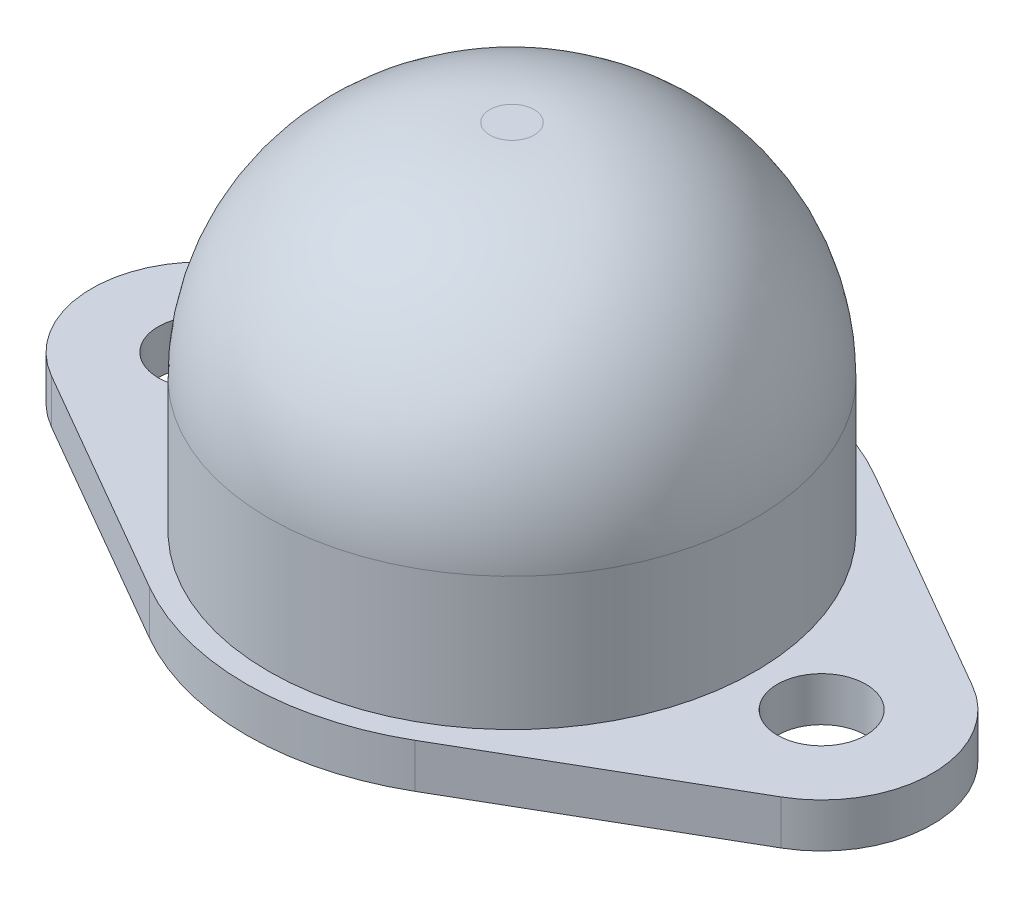
from build123d import *

# Parameters (mm, degrees)
BOSS_EXTRUDE1_DEPTH = 1
SKETCH2_R           = 5.5
BOSS_EXTRUDE2_DEPTH = 8
FILLET1_R           = 5


with BuildPart() as part:
    # Sketch1 → Boss-Extrude1 (new body)
    with BuildSketch(Plane(origin=(0, 0, 0), x_dir=(1, 0, 0), z_dir=(0, 1, 0))):
        with BuildLine():
            ThreePointArc((-8, 0), (-7, 1), (-6, 0))
            ThreePointArc((-6, 0), (-5.905505906, 1.060660172), (-5.625, 2.087911636))
            ThreePointArc((-5.625, 2.087911636), (-6.926553741, 2.498920897), (-8.25, 2.165063509))
            ThreePointArc((-8.25, 2.165063509), (-9.165063509, 1.25), (-9.5, 0))
            Line((-9.5, 0), (-8, 0))
        make_face()
        with BuildLine():
            ThreePointArc((-5.625, -2.087911636), (-5.905505906, -1.060660172), (-6, 0))
            ThreePointArc((-6, 0), (-7, -1), (-8, 0))
            Line((-8, 0), (-9.5, 0))
            ThreePointArc((-9.5, 0), (-9.165063509, -1.25), (-8.25, -2.165063509))
            ThreePointArc((-8.25, -2.165063509), (-6.926553741, -2.498920897), (-5.625, -2.087911636))
        make_face()
        with BuildLine():
            ThreePointArc((-5.625, 2.087911636), (-5.905505906, 1.060660172), (-6, 0))
            Line((-6, 0), (-4.5, 0))
            ThreePointArc((-4.5, 0), (-4.799147892, 1.185854123), (-5.625, 2.087911636))
        make_face()
        with BuildLine():
            Line((-4.5, 0), (-6, 0))
            ThreePointArc((-6, 0), (-5.905505906, -1.060660172), (-5.625, -2.087911636))
            ThreePointArc((-5.625, -2.087911636), (-4.799147892, -1.185854123), (-4.5, 0))
        make_face()
        with BuildLine():
            ThreePointArc((-8.25, 2.165063509), (-6.926553741, 2.498920897), (-5.625, 2.087911636))
            ThreePointArc((-5.625, 2.087911636), (-4.58398805, 3.871311606), (-3, 5.196152423))
            Line((-3, 5.196152423), (-8.25, 2.165063509))
        make_face()
        with BuildLine():
            ThreePointArc((-3, -5.196152423), (-4.58398805, -3.871311606), (-5.625, -2.087911636))
            ThreePointArc((-5.625, -2.087911636), (-6.926553741, -2.498920897), (-8.25, -2.165063509))
            Line((-8.25, -2.165063509), (-3, -5.196152423))
        make_face()
        with BuildLine():
            Line((4.5, 0), (-4.5, 0))
            ThreePointArc((-4.5, 0), (-4.799147892, -1.185854123), (-5.625, -2.087911636))
            ThreePointArc((-5.625, -2.087911636), (-4.58398805, -3.871311606), (-3, -5.196152423))
            Line((-3, -5.196152423), (3, -5.196152423))
            ThreePointArc((3, -5.196152423), (4.58398805, -3.871311606), (5.625, -2.087911636))
            ThreePointArc((5.625, -2.087911636), (4.799147892, -1.185854123), (4.5, 0))
        make_face()
        with BuildLine():
            ThreePointArc((-5.625, 2.087911636), (-4.799147892, 1.185854123), (-4.5, 0))
            Line((-4.5, 0), (4.5, 0))
            ThreePointArc((4.5, 0), (4.799147892, 1.185854123), (5.625, 2.087911636))
            ThreePointArc((5.625, 2.087911636), (4.58398805, 3.871311606), (3, 5.196152423))
            ThreePointArc((3, 5.196152423), (0, 6), (-3, 5.196152423))
            ThreePointArc((-3, 5.196152423), (-4.58398805, 3.871311606), (-5.625, 2.087911636))
        make_face()
        with BuildLine():
            Line((3, -5.196152423), (-3, -5.196152423))
            ThreePointArc((-3, -5.196152423), (0, -6), (3, -5.196152423))
        make_face()
        with BuildLine():
            ThreePointArc((3, 5.196152423), (4.58398805, 3.871311606), (5.625, 2.087911636))
            ThreePointArc((5.625, 2.087911636), (6.926553741, 2.498920897), (8.25, 2.165063509))
            Line((8.25, 2.165063509), (3, 5.196152423))
        make_face()
        with BuildLine():
            ThreePointArc((8.25, -2.165063509), (6.926553741, -2.498920897), (5.625, -2.087911636))
            ThreePointArc((5.625, -2.087911636), (4.58398805, -3.871311606), (3, -5.196152423))
            Line((3, -5.196152423), (8.25, -2.165063509))
        make_face()
        with BuildLine():
            ThreePointArc((5.625, 2.087911636), (4.799147892, 1.185854123), (4.5, 0))
            Line((4.5, 0), (6, 0))
            ThreePointArc((6, 0), (5.905505906, 1.060660172), (5.625, 2.087911636))
        make_face()
        with BuildLine():
            Line((6, 0), (4.5, 0))
            ThreePointArc((4.5, 0), (4.799147892, -1.185854123), (5.625, -2.087911636))
            ThreePointArc((5.625, -2.087911636), (5.905505906, -1.060660172), (6, 0))
        make_face()
        with BuildLine():
            ThreePointArc((8, 0), (7, -1), (6, 0))
            ThreePointArc((6, 0), (5.905505906, -1.060660172), (5.625, -2.087911636))
            ThreePointArc((5.625, -2.087911636), (6.926553741, -2.498920897), (8.25, -2.165063509))
            Line((8.25, -2.165063509), (8.25, 0))
            Line((8.25, 0), (8, 0))
        make_face()
        with BuildLine():
            ThreePointArc((5.625, 2.087911636), (5.905505906, 1.060660172), (6, 0))
            ThreePointArc((6, 0), (7, 1), (8, 0))
            Line((8, 0), (8.25, 0))
            Line((8.25, 0), (8.25, 2.165063509))
            ThreePointArc((8.25, 2.165063509), (6.926553741, 2.498920897), (5.625, 2.087911636))
        make_face()
        with BuildLine():
            ThreePointArc((9.5, 0), (9.165063509, 1.25), (8.25, 2.165063509))
            Line((8.25, 2.165063509), (8.25, 0))
            Line((8.25, 0), (9.5, 0))
        make_face()
        with BuildLine():
            Line((8.25, 0), (8.25, -2.165063509))
            ThreePointArc((8.25, -2.165063509), (9.165063509, -1.25), (9.5, 0))
            Line((9.5, 0), (8.25, 0))
        make_face()
    extrude(amount=BOSS_EXTRUDE1_DEPTH)

    # Sketch2 → Boss-Extrude2 (add)
    with BuildSketch(Plane(origin=(0, 1, 0), x_dir=(1, 0, 0), z_dir=(0, 1, 0))):
        with Locations(Location((0, 0, 0), (0, 0, 270))):
            Circle(SKETCH2_R)
    extrude(amount=BOSS_EXTRUDE2_DEPTH)

    # Fillet1
    fillet1_edges = [part.edges().sort_by_distance(p)[0] for p in [
        (0, 9, -5.5),
    ]]
    fillet(fillet1_edges, radius=FILLET1_R)


solid = part.part
